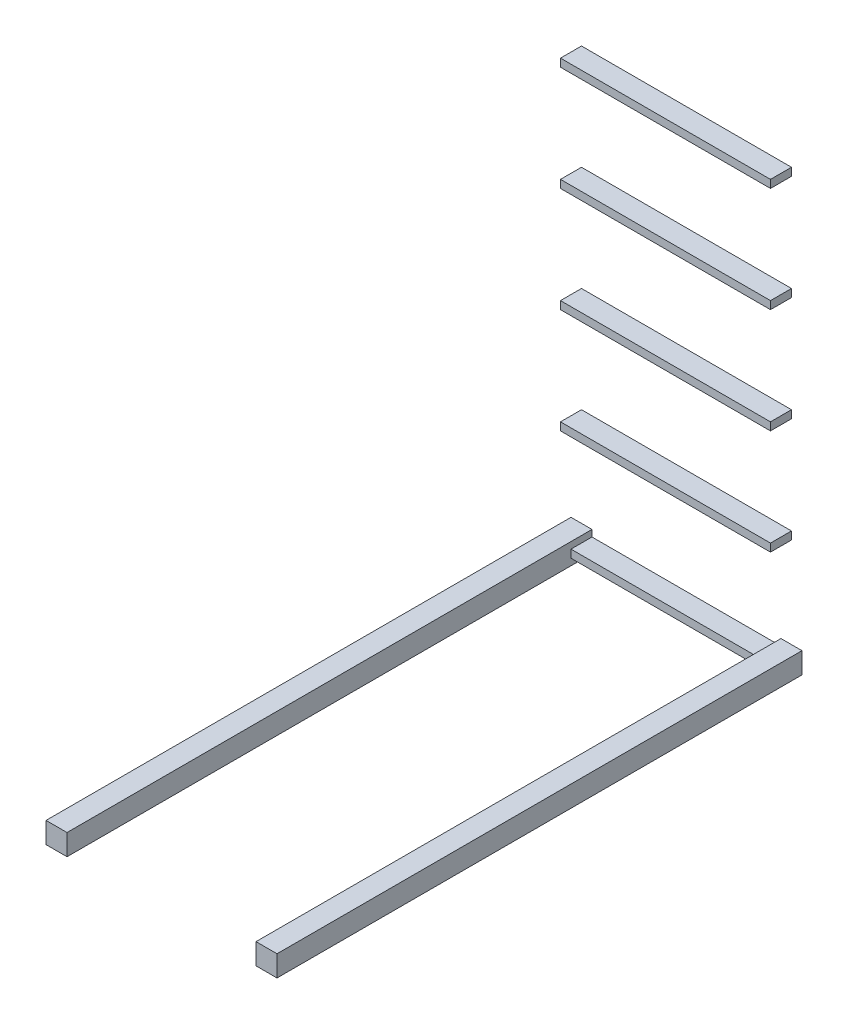
from build123d import *

# Parameters (mm, degrees)
SKETCH_1_W      = 80
SKETCH_1_H      = 80
EXTRUDE_1_DEPTH = 2000
SKETCH_2_W      = 80
SKETCH_2_H      = 80
EXTRUDE_2_DEPTH = 2000
SKETCH_3_W      = 800
SKETCH_3_H      = 30
EXTRUDE_3_DEPTH = 80
SKETCH_4_W      = 800
SKETCH_4_H      = 30
EXTRUDE_4_DEPTH = 80
SKETCH_5_W      = 800
SKETCH_5_H      = 30
EXTRUDE_5_DEPTH = 80
SKETCH_6_W      = 800
SKETCH_6_H      = 30
EXTRUDE_6_DEPTH = 80
SKETCH_7_W      = 800
SKETCH_7_H      = 30
EXTRUDE_7_DEPTH = 80


with BuildPart() as part:
    # 草图1 → 凸台-拉伸1 (new body)
    with BuildSketch(Plane.XY):
        with Locations((-400, 0)):
            Rectangle(SKETCH_1_W, SKETCH_1_H)
    extrude(amount=EXTRUDE_1_DEPTH)



with BuildPart() as body_2:
    # 草图2 → 凸台-拉伸2 (new body)
    with BuildSketch(Plane.XY):
        with Locations((400, 0)):
            Rectangle(SKETCH_2_W, SKETCH_2_H)
    extrude(amount=EXTRUDE_2_DEPTH)


with BuildPart() as part_1:
    add(part.part)

    add(body_2.part)  # 凸台-拉伸3 merges body 2
    # 草图3 → 凸台-拉伸3 (add)
    with BuildSketch(Plane.XY):
        Rectangle(SKETCH_3_W, SKETCH_3_H)
    extrude(amount=EXTRUDE_3_DEPTH)


with BuildPart() as body_2_2:
    # 草图4 → 凸台-拉伸4 (new body)
    with BuildSketch(Plane.XY):
        with Locations((0, 400)):
            Rectangle(SKETCH_4_W, SKETCH_4_H)
    extrude(amount=EXTRUDE_4_DEPTH)


with BuildPart() as body_3:
    # 草图5 → 凸台-拉伸5 (new body)
    with BuildSketch(Plane.XY):
        with Locations((0, 800)):
            Rectangle(SKETCH_5_W, SKETCH_5_H)
    extrude(amount=EXTRUDE_5_DEPTH)


with BuildPart() as body_4:
    # 草图6 → 凸台-拉伸6 (new body)
    with BuildSketch(Plane.XY):
        with Locations((0, 1200)):
            Rectangle(SKETCH_6_W, SKETCH_6_H)
    extrude(amount=EXTRUDE_6_DEPTH)


with BuildPart() as body_5:
    # 草图7 → 凸台-拉伸7 (new body)
    with BuildSketch(Plane.XY):
        with Locations((0, 1600)):
            Rectangle(SKETCH_7_W, SKETCH_7_H)
    extrude(amount=EXTRUDE_7_DEPTH)


solid = Compound([part_1.part, body_2_2.part, body_3.part, body_4.part, body_5.part])
